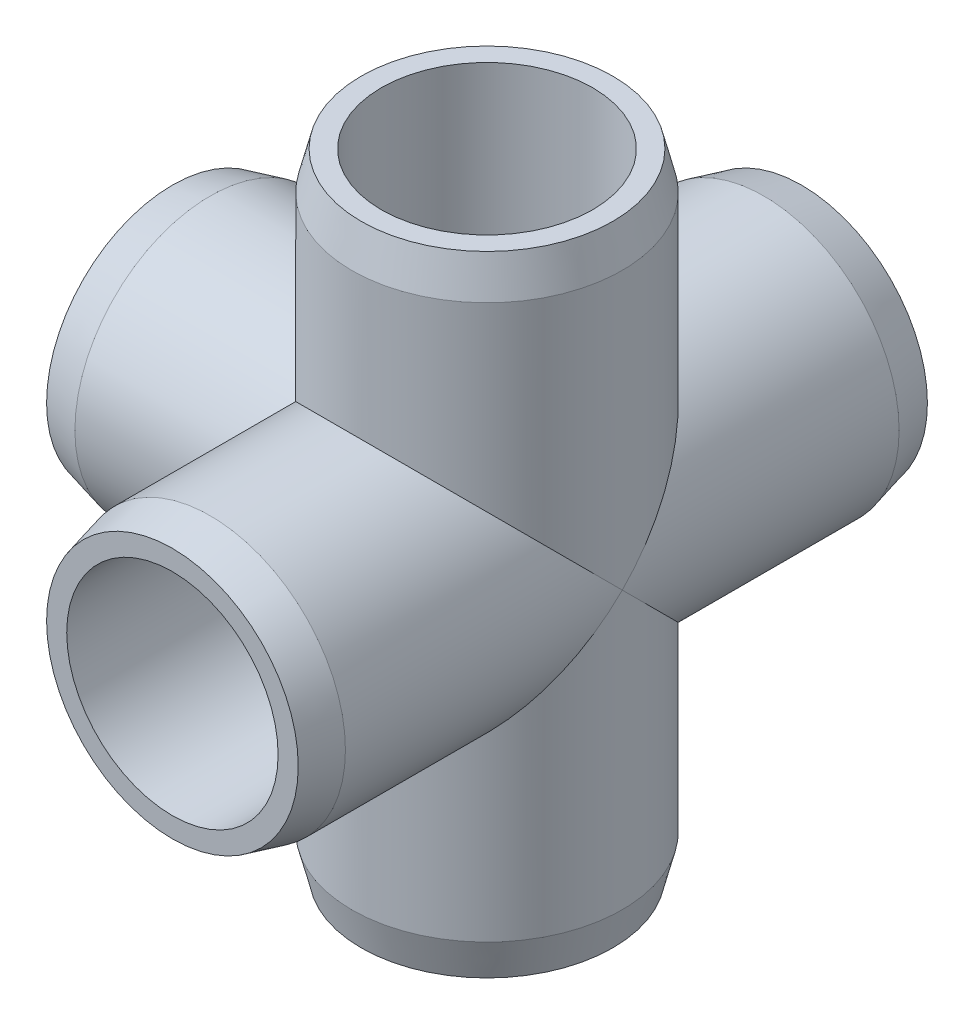
from build123d import *
from build123d.topology import SkipClean

# Parameters (mm, degrees)
SKETCH1_R                = 13.6525
SKETCH1_R_2              = 10.668
BOSS_EXTRUDE1_DEPTH      = 63.5
SKETCH3_R                = 10.668
CUT_EXTRUDE2_DEPTH       = 38.1
BOSS_EXTRUDE2_START      = 63.5
SKETCH4_R                = 13.6525
SKETCH4_R_2              = 10.668
BOSS_EXTRUDE2_DEPTH      = 63.5
SKETCH5_R                = 10.668
CUT_EXTRUDE3_DEPTH       = 69.85
BOSS_EXTRUDE3_REACH      = 86.272
BOSS_EXTRUDE3_END_RADIUS = 13.6525
SKETCH6_R                = 13.6525
SKETCH6_R_2              = 10.668
CUT_EXTRUDE5_DEPTH       = 304.8
CUT_EXTRUDE5_DEPTH_BACK  = 69.85
SKETCH8_R                = 10.668
SKETCH11_W               = 1.27
SKETCH11_H               = 1.905
SKETCH12_W               = 1.905
SKETCH12_H               = 1.27
SKETCH13_W               = 1.905
SKETCH13_H               = 1.27
SKETCH18_R               = 10.668
CUT_EXTRUDE6_DEPTH       = 63.5
SKETCH19_W               = 1.27
SKETCH19_H               = 1.905


with BuildPart() as part:
    # Sketch1 → Boss-Extrude1 (new body)
    with BuildSketch(Plane(origin=(0, 0, 0), x_dir=(1, 0, 0), z_dir=(0, 1, 0))):
        with Locations(Location((0, 0, 0), (0, 0, 270))):
            Circle(SKETCH1_R)
        with Locations(Location((0, 0, 0), (0, 0, 270))):
            Circle(SKETCH1_R_2, mode=Mode.SUBTRACT)
    extrude(amount=BOSS_EXTRUDE1_DEPTH)

    # Sketch3 → Cut-Extrude2 (cut)
    with BuildSketch(Plane.XY):
        with Locations((0, 31.75)):
            Circle(SKETCH3_R)
    extrude(amount=-CUT_EXTRUDE2_DEPTH, mode=Mode.SUBTRACT)

    # Sketch4 → Boss-Extrude2 (add)
    with SkipClean():  # the faces are left unmerged after this step: merging them gives an invalid solid
        with BuildSketch(Plane.XY.offset(-31.75).offset(BOSS_EXTRUDE2_START)):
            with Locations((0, 31.75)):
                Circle(SKETCH4_R)
            with Locations(Location((0, 31.75, 0), (0, 0, 180))):
                Circle(SKETCH4_R_2, mode=Mode.SUBTRACT)
        extrude(amount=-BOSS_EXTRUDE2_DEPTH)

    # Sketch5 → Cut-Extrude3 (cut)
    with SkipClean():  # the faces are left unmerged after this step: merging them gives an invalid solid
        with BuildSketch(Plane(origin=(0, 0, 0), x_dir=(0, 0, -1), z_dir=(1, 0, 0))):
            with Locations(Location((0, 31.75, 0), (0, 0, 225.000000025))):
                Circle(SKETCH5_R)
        extrude(amount=-CUT_EXTRUDE3_DEPTH, mode=Mode.SUBTRACT)

    # Boss-Extrude3: up to this cylinder (the profile starts outside it)
    with SkipClean():  # the faces are left unmerged after this step: merging them gives an invalid solid
        boss_extrude3_end = Plane(origin=(0, 41.130725, 0), z_dir=(0, -1, 0)) * Cylinder(BOSS_EXTRUDE3_END_RADIUS, 200.849, mode=Mode.PRIVATE)
        # Sketch6 → Boss-Extrude3 (add, up to the surface)
        with BuildSketch(Plane(origin=(-31.75, 0, 0), x_dir=(0, 0, -1), z_dir=(1, 0, 0)), mode=Mode.PRIVATE) as boss_extrude3_sk1:
            with Locations(Location((0, 31.75, 0), (0, 0, 225))):
                Circle(SKETCH6_R)
            with Locations((0, 31.75)):
                Circle(SKETCH6_R_2, mode=Mode.SUBTRACT)
        boss_extrude3_tool1 = extrude(boss_extrude3_sk1.sketch, amount=BOSS_EXTRUDE3_REACH, mode=Mode.PRIVATE) - boss_extrude3_end
        add(boss_extrude3_tool1.solids().sort_by_distance((-31.75, 41.130725, -9.380725))[0])

    # Sketch8 → Cut-Extrude5 (cut, two sides: drawn at the far end of the back side and taken through both)
    with BuildSketch(Plane.XY.offset(-CUT_EXTRUDE5_DEPTH_BACK)):
        with Locations((0, 31.75)):
            Circle(SKETCH8_R)
    extrude(amount=CUT_EXTRUDE5_DEPTH + CUT_EXTRUDE5_DEPTH_BACK, mode=Mode.SUBTRACT)

    # Sketch11 → Revolve5 (revolve)
    with SkipClean():  # the faces are left unmerged after this step: merging them gives an invalid solid
        with BuildSketch(Plane.XY, mode=Mode.PRIVATE) as revolve5_sk:
            with Locations((-9.8425, 20.0025)):
                Rectangle(SKETCH11_W, SKETCH11_H)
        revolve(revolve5_sk.sketch.rotate(Axis((0, 0, 0), (0, 1, 0)), 315), axis=Axis((0, 0, 0), (0, 1, 0)))

    # Sketch13 → Revolve7 (revolve)
    with SkipClean():  # the faces are left unmerged after this step: merging them gives an invalid solid
        with BuildSketch(Plane(origin=(0, 0, 0), x_dir=(0, 0, -1), z_dir=(1, 0, 0)), mode=Mode.PRIVATE) as revolve7_sk:
            with Locations((11.7475, 41.783)):
                Rectangle(SKETCH13_W, SKETCH13_H)
        revolve7 = revolve(revolve7_sk.sketch.rotate(Axis((0, 31.75, -31.75), (0, 0, 1)), 270), axis=Axis((0, 31.75, -31.75), (0, 0, 1)))

    # Sketch14 → Cut-Revolve1 (revolve, cut)
    with SkipClean():  # the faces are left unmerged after this step: merging them gives an invalid solid
        with BuildSketch(Plane(origin=(0, 0, 0), x_dir=(0, 0, -1), z_dir=(1, 0, 0)), mode=Mode.PRIVATE) as cut_revolve1_sk:
            Polygon((13.6525, 0), (13.6525, 3.81), (12.7, 0), align=None)
        cut_revolve1 = revolve(cut_revolve1_sk.sketch.rotate(Axis((0, 0, 0), (0, 1, 0)), 45), axis=Axis((0, 0, 0), (0, 1, 0)), mode=Mode.SUBTRACT)

    # Mirror1: Cut-Revolve1 across plane
    with SkipClean():  # the faces are left unmerged after this step: merging them gives an invalid solid
        add(cut_revolve1.mirror(Plane.ZX.offset(31.75)), mode=Mode.SUBTRACT)

    # Sketch15 → Cut-Revolve2 (revolve, cut)
    with SkipClean():  # the faces are left unmerged after this step: merging them gives an invalid solid
        with BuildSketch(Plane(origin=(0, 31.75, 0), x_dir=(1, 0, 0), z_dir=(0, 1, 0)), mode=Mode.PRIVATE) as cut_revolve2_sk:
            Polygon((-13.6525, 31.75), (-13.6525, 27.94), (-12.7, 31.75), align=None)
        cut_revolve2 = revolve(cut_revolve2_sk.sketch.rotate(Axis((0, 31.75, -31.75), (0, 0, 1)), 270), axis=Axis((0, 31.75, -31.75), (0, 0, 1)), mode=Mode.SUBTRACT)

    # Sketch16 → Cut-Revolve3 (revolve, cut)
    with SkipClean():  # the faces are left unmerged after this step: merging them gives an invalid solid
        with BuildSketch(Plane(origin=(0, 31.75, 0), x_dir=(1, 0, 0), z_dir=(0, 1, 0))):
            Polygon((-31.75, -13.6525), (-27.94, -13.6525), (-31.75, -12.7), align=None)
        revolve(axis=Axis((-31.75, 31.75, 0), (1, 0, 0)), mode=Mode.SUBTRACT)

    # Sketch18 → Cut-Extrude6 (cut)
    with SkipClean():  # the faces are left unmerged after this step: merging them gives an invalid solid
        with BuildSketch(Plane.XZ):
            with Locations(Location((0, 0, 0), (0, 0, 225))):
                Circle(SKETCH18_R)
        extrude(amount=-CUT_EXTRUDE6_DEPTH, mode=Mode.SUBTRACT)

    # Mirror2: Cut-Revolve2 across plane
    with SkipClean():  # the faces are left unmerged after this step: merging them gives an invalid solid
        add(cut_revolve2.mirror(Plane.XY), mode=Mode.SUBTRACT)

    # Mirror3: Revolve7 across plane
    with SkipClean():  # the faces are left unmerged after this step: merging them gives an invalid solid
        add(revolve7.mirror(Plane(origin=(0, 0, 0), x_dir=(1, 0, 0), z_dir=(0, 0, -1))))

    # Sketch19 → Revolve8 (revolve)
    with SkipClean():  # the faces are left unmerged after this step: merging them gives an invalid solid
        with BuildSketch(Plane(origin=(0, 0, 0), x_dir=(0, 0, -1), z_dir=(1, 0, 0)), mode=Mode.PRIVATE) as revolve8_sk:
            with Locations((-10.033, 20.0025)):
                Rectangle(SKETCH19_W, SKETCH19_H)
        revolve8 = revolve(revolve8_sk.sketch.rotate(Axis((0, 0, 0), (0, 1, 0)), 180), axis=Axis((0, 0, 0), (0, 1, 0)))

    # Mirror4: Revolve8 across plane
    with SkipClean():  # the faces are left unmerged after this step: merging them gives an invalid solid
        add(revolve8.mirror(Plane.ZX.offset(31.75)))


with BuildPart() as body_2:
    # Sketch12 → Revolve6 (revolve)
    with BuildSketch(Plane.XY, mode=Mode.PRIVATE) as revolve6_sk:
        with Locations((-11.7475, 41.5925)):
            Rectangle(SKETCH12_W, SKETCH12_H)
    revolve(revolve6_sk.sketch.rotate(Axis((-31.75, 31.75, 0), (1, 0, 0)), 90), axis=Axis((-31.75, 31.75, 0), (1, 0, 0)))


solid = Compound([part.part, body_2.part])
